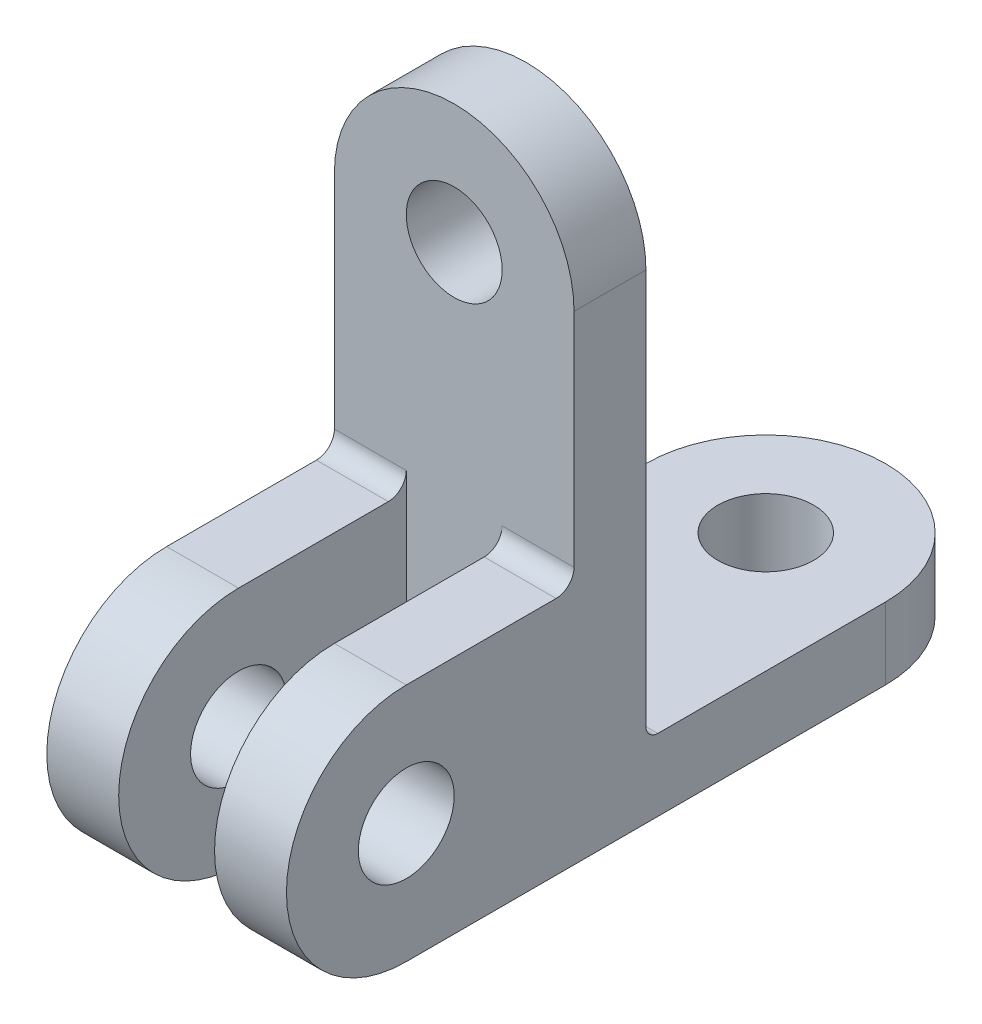
from build123d import *

# Parameters (mm, degrees)
BOSS_EXTRUDE3_DEPTH = 12
BOSS_EXTRUDE4_DEPTH = 20
BOSS_EXTRUDE5_DEPTH = 12
SKETCH12_W          = 16
SKETCH12_H          = 40
CUT_EXTRUDE1_DEPTH  = 96.833188406
SKETCH13_R          = 8
CUT_EXTRUDE2_DEPTH  = 94.808315196
SKETCH14_R          = 8
CUT_EXTRUDE3_DEPTH  = 96.833188406
SKETCH15_R          = 8
CUT_EXTRUDE4_DEPTH  = 119.321595662
FILLET1_R           = 3
FILLET2_R           = 2


with BuildPart() as part:
    # Sketch7 → Boss-Extrude3 (new body)
    with BuildSketch(Plane(origin=(0, 0, 0), x_dir=(0, 1, 0), z_dir=(0, 0, 1))):
        with BuildLine():
            Line((0, -20), (0, 20))
            Line((0, 20), (40, 20))
            ThreePointArc((40, 20), (60, 0), (40, -20))
            Line((40, -20), (0, -20))
        make_face()
    extrude(amount=BOSS_EXTRUDE3_DEPTH)

    # Sketch9 → Boss-Extrude4 (add, symmetric)
    with BuildSketch(Plane.YZ):
        with BuildLine():
            Line((0, 0), (-40, 0))
            Line((-40, 0), (-40, 40))
            ThreePointArc((-40, 40), (-20, 60), (0, 40))
            Line((0, 40), (0, 0))
        make_face()
    extrude(amount=BOSS_EXTRUDE4_DEPTH, both=True)

    # Sketch10 → Boss-Extrude5 (add)
    with BuildSketch(Plane.XZ.offset(40)):
        with BuildLine():
            Line((-20, 0), (20, 0))
            Line((20, 0), (20, -39.999997874))
            ThreePointArc((20, -39.999997874), (1.063e-06, -60), (-20, -40))
            Line((-20, -40), (-20, 0))
        make_face()
    extrude(amount=-BOSS_EXTRUDE5_DEPTH)

    # Sketch12 → Cut-Extrude1 (cut, through all)
    with BuildSketch(Plane.XY.offset(12)):
        with Locations((0, -20)):
            Rectangle(SKETCH12_W, SKETCH12_H)
    extrude(amount=CUT_EXTRUDE1_DEPTH, mode=Mode.SUBTRACT)

    # Sketch13 → Cut-Extrude2 (cut, through all)
    with BuildSketch(Plane.YZ.offset(20)):
        with Locations((-20, 40)):
            Circle(SKETCH13_R)
    extrude(amount=-CUT_EXTRUDE2_DEPTH, mode=Mode.SUBTRACT)

    # Sketch14 → Cut-Extrude3 (cut, through all)
    with BuildSketch(Plane.XY.offset(12)):
        with Locations((0, 40)):
            Circle(SKETCH14_R)
    extrude(amount=-CUT_EXTRUDE3_DEPTH, mode=Mode.SUBTRACT)

    # Sketch15 → Cut-Extrude4 (cut, through all)
    with BuildSketch(Plane.XZ.offset(40)):
        with Locations(Location((0, -40, 0), (0, 0, 270))):
            Circle(SKETCH15_R)
    extrude(amount=-CUT_EXTRUDE4_DEPTH, mode=Mode.SUBTRACT)

    # Fillet1
    fillet1_edges = [part.edges().sort_by_distance(p)[0] for p in [
        (14, 0, 12),
        (-14, 0, 12),
    ]]
    fillet(fillet1_edges, radius=FILLET1_R)

    # Fillet2
    fillet2_edges = [part.edges().sort_by_distance(p)[0] for p in [
        (0, -28, 0),
    ]]
    fillet(fillet2_edges, radius=FILLET2_R)


solid = part.part
